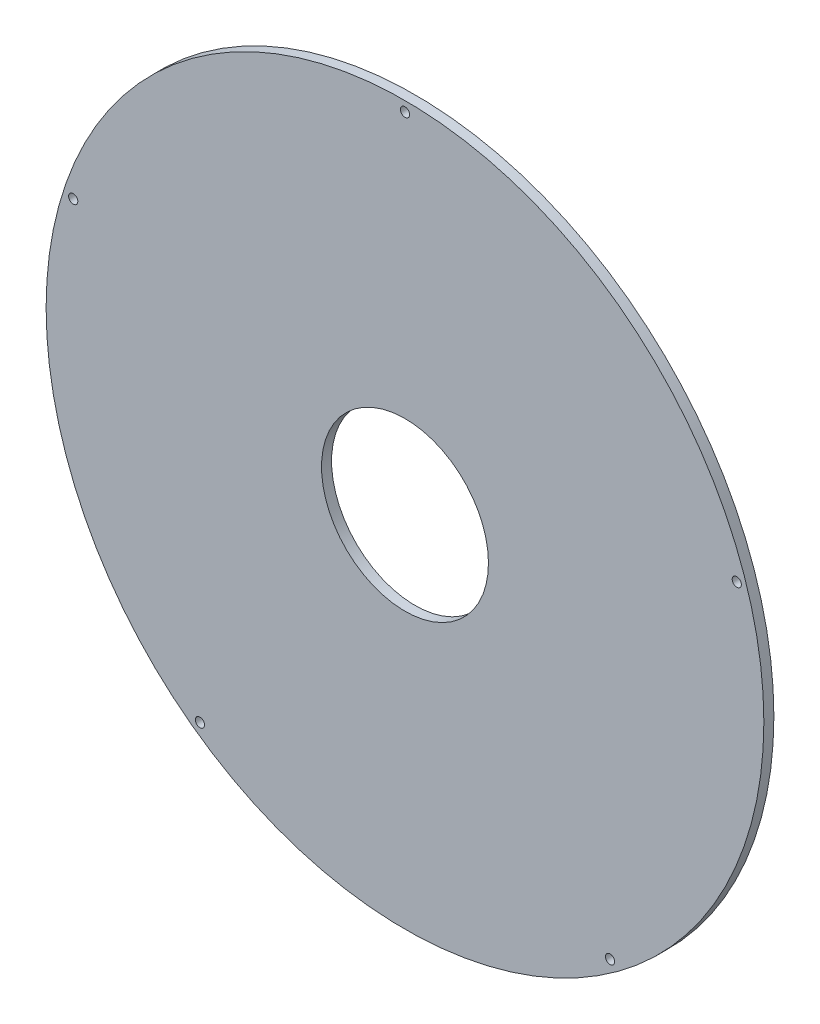
from build123d import *

# Parameters (mm, degrees)
SKETCH1_R       = 215
SKETCH1_R_2     = 50
LID_DEPTH       = 6
SKETCH2_R       = 2.75
ROD_HOLES_DEPTH = 6


with BuildPart() as part:
    # Sketch1 → Lid (new body)
    with BuildSketch(Plane.XY):
        Circle(SKETCH1_R)
        Circle(SKETCH1_R_2, mode=Mode.SUBTRACT)
    extrude(amount=LID_DEPTH)

    # Sketch2 → Rod_holes (cut)
    with BuildSketch(Plane.XY):
        with Locations((198.770811906, 64.584551824)):
            Circle(SKETCH2_R)
        with Locations((0, 209)):
            Circle(SKETCH2_R)
        with Locations((-198.770811906, 64.584551824)):
            Circle(SKETCH2_R)
        with Locations((-122.847117729, -169.084551824)):
            Circle(SKETCH2_R)
        with Locations((122.847117729, -169.084551824)):
            Circle(SKETCH2_R)
    extrude(amount=ROD_HOLES_DEPTH, mode=Mode.SUBTRACT)


solid = part.part
